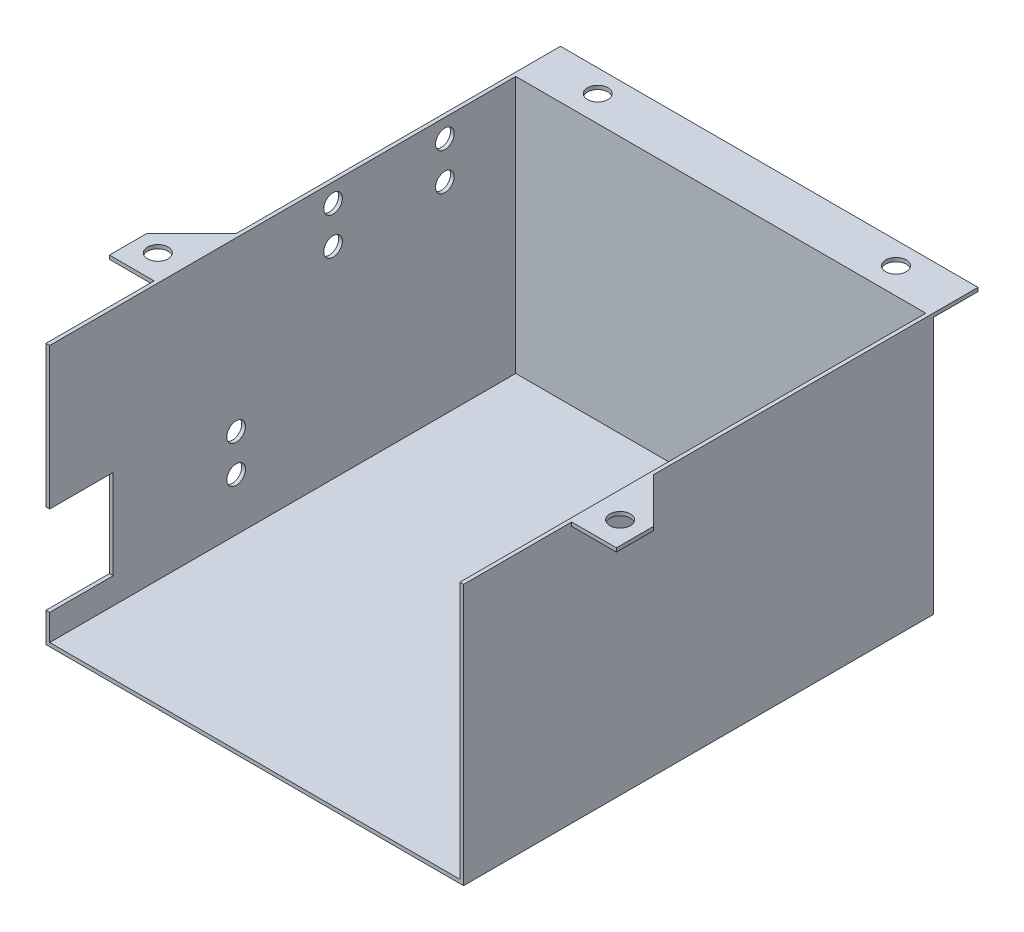
from build123d import *

# Parameters (mm, degrees)
SKETCH_1_W          = 112
SKETCH_1_H          = 70
EXTRUDE_1_DEPTH     = 126
SKETCH_2_W          = 110
SKETCH_2_H          = 69
CUT_EXTRUDE_1_DEPTH = 125
SKETCH_3_W          = 112
SKETCH_3_H          = 1
EXTRUDE_2_DEPTH     = 12
SKETCH_4_W          = 22
SKETCH_4_H          = 1
EXTRUDE_3_DEPTH     = 12
CUT_EXTRUDE_2_DEPTH = 10
SKETCH_6_R          = 2.75
CUT_EXTRUDE_3_DEPTH = 190.770914526
CUT_EXTRUDE_5_REACH = 192.137
SKETCH_8_W          = 17
SKETCH_8_H          = 24
SKETCH_9_R          = 2.5
CUT_EXTRUDE_6_DEPTH = 10


with BuildPart() as part:
    # 草图1 → 拉伸1 (new body)
    with BuildSketch(Plane.XY):
        with Locations((56, 35)):
            Rectangle(SKETCH_1_W, SKETCH_1_H)
    extrude(amount=EXTRUDE_1_DEPTH)

    # 草图2 → 切除-拉伸1 (cut)
    with BuildSketch(Plane.XY.offset(126)):
        with Locations((56, 35.5)):
            Rectangle(SKETCH_2_W, SKETCH_2_H)
    extrude(amount=-CUT_EXTRUDE_1_DEPTH, mode=Mode.SUBTRACT)

    # 草图3 → 拉伸2 (add)
    with BuildSketch(Plane(origin=(0, 0, 0), x_dir=(-1, 0, 0), z_dir=(0, 0, -1))):
        with Locations((-56, 69.5)):
            Rectangle(SKETCH_3_W, SKETCH_3_H)
    extrude(amount=EXTRUDE_2_DEPTH)

    # 草图4 → 拉伸3 (add)
    with BuildSketch(Plane(origin=(112, 0, 0), x_dir=(0, 0, -1), z_dir=(1, 0, 0))):
        with Locations((-86, 69.5)):
            Rectangle(SKETCH_4_W, SKETCH_4_H)
    extrude_3 = extrude(amount=EXTRUDE_3_DEPTH)

    # 草图5 → 切除-拉伸2 (cut)
    with BuildSketch(Plane(origin=(0, 70, 0), x_dir=(-1, 0, 0), z_dir=(0, 1, 0))):
        Polygon((-112, 75), (-124, 87), (-124, 75), align=None)
    cut_extrude_2 = extrude(amount=-CUT_EXTRUDE_2_DEPTH, mode=Mode.SUBTRACT)

    # 镜向1: 拉伸3 across plane
    add(extrude_3.mirror(Plane.ZY.offset(-56)))

    # 镜向2: 切除-拉伸2 across plane
    add(cut_extrude_2.mirror(Plane.ZY.offset(-56)), mode=Mode.SUBTRACT)

    # 草图6 → 切除-拉伸3 (cut, through all)
    with BuildSketch(Plane.XZ.offset(-69)):
        with Locations(Location((-6, 90, 0), (0, 0, 270))):
            Circle(SKETCH_6_R)
        with Locations(Location((118, 90, 0), (0, 0, 270))):
            Circle(SKETCH_6_R)
        with Locations(Location((16, -6, 0), (0, 0, 270))):
            Circle(SKETCH_6_R)
        with Locations(Location((96, -6, 0), (0, 0, 270))):
            Circle(SKETCH_6_R)
    extrude(amount=-CUT_EXTRUDE_3_DEPTH, mode=Mode.SUBTRACT)

    # 草图8 → 切除-拉伸5 (cut, up to next)
    with BuildSketch(Plane.ZY, mode=Mode.PRIVATE) as cut_extrude_5_sk1:
        with Locations((117.5, 20)):
            Rectangle(SKETCH_8_W, SKETCH_8_H)
    cut_extrude_5_tool1 = extrude(cut_extrude_5_sk1.sketch, amount=-CUT_EXTRUDE_5_REACH, mode=Mode.PRIVATE) & part.part
    add(cut_extrude_5_tool1.solids().sort_by_distance((0, 20, 117.5))[0], mode=Mode.SUBTRACT)

    # 草图9 → 切除-拉伸6 (cut)
    with BuildSketch(Plane.ZY):
        with Locations((20, 65)):
            Circle(SKETCH_9_R)
        with Locations((20, 55)):
            Circle(SKETCH_9_R)
        with Locations((50, 65)):
            Circle(SKETCH_9_R)
        with Locations((50, 55)):
            Circle(SKETCH_9_R)
        with Locations((76, 25)):
            Circle(SKETCH_9_R)
        with Locations((76, 15)):
            Circle(SKETCH_9_R)
    extrude(amount=-CUT_EXTRUDE_6_DEPTH, mode=Mode.SUBTRACT)


solid = part.part
